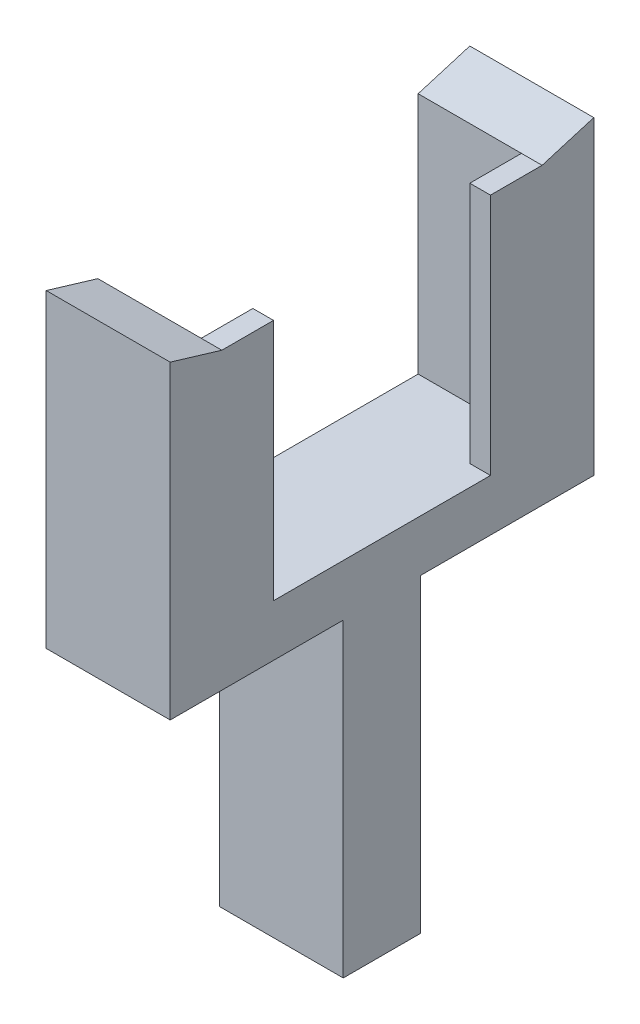
from build123d import *

# Parameters (mm, degrees)
BOSS_EXTRUDE1_DEPTH = 6
SKETCH2_W           = 2
SKETCH2_H           = 23.5
BOSS_EXTRUDE2_DEPTH = 5


with BuildPart() as part:
    # Sketch1 → Boss-Extrude1 (new, symmetric)
    with BuildSketch(Plane(origin=(0, 0, 0), x_dir=(0, 0, -1), z_dir=(1, 0, 0))):
        Polygon((-3.75, -29.358843537), (-3.75, 0.641156463), (-20.5, 0.641156463), (-20.5, 30.641156463), (-15.5, 29.141156463), (-15.5, 5.641156463), (15.5, 5.641156463), (15.5, 29.141156463), (20.5, 30.641156463), (20.5, 0.641156463), (3.75, 0.641156463), (3.75, -29.358843537), align=None)
    extrude(amount=BOSS_EXTRUDE1_DEPTH, both=True)

    # Sketch2 → Boss-Extrude2 (add)
    with BuildSketch(Plane(origin=(0, 0, 15.5), x_dir=(-1, 0, 0), z_dir=(0, 0, -1))):
        with Locations((-5, 17.391156463)):
            Rectangle(SKETCH2_W, SKETCH2_H)
    boss_extrude2 = extrude(amount=BOSS_EXTRUDE2_DEPTH)

    # Mirror1: Boss-Extrude2 across plane
    add(boss_extrude2.mirror(Plane(origin=(0, 0, 0), x_dir=(1, 0, 0), z_dir=(0, 0, -1))))


solid = part.part
